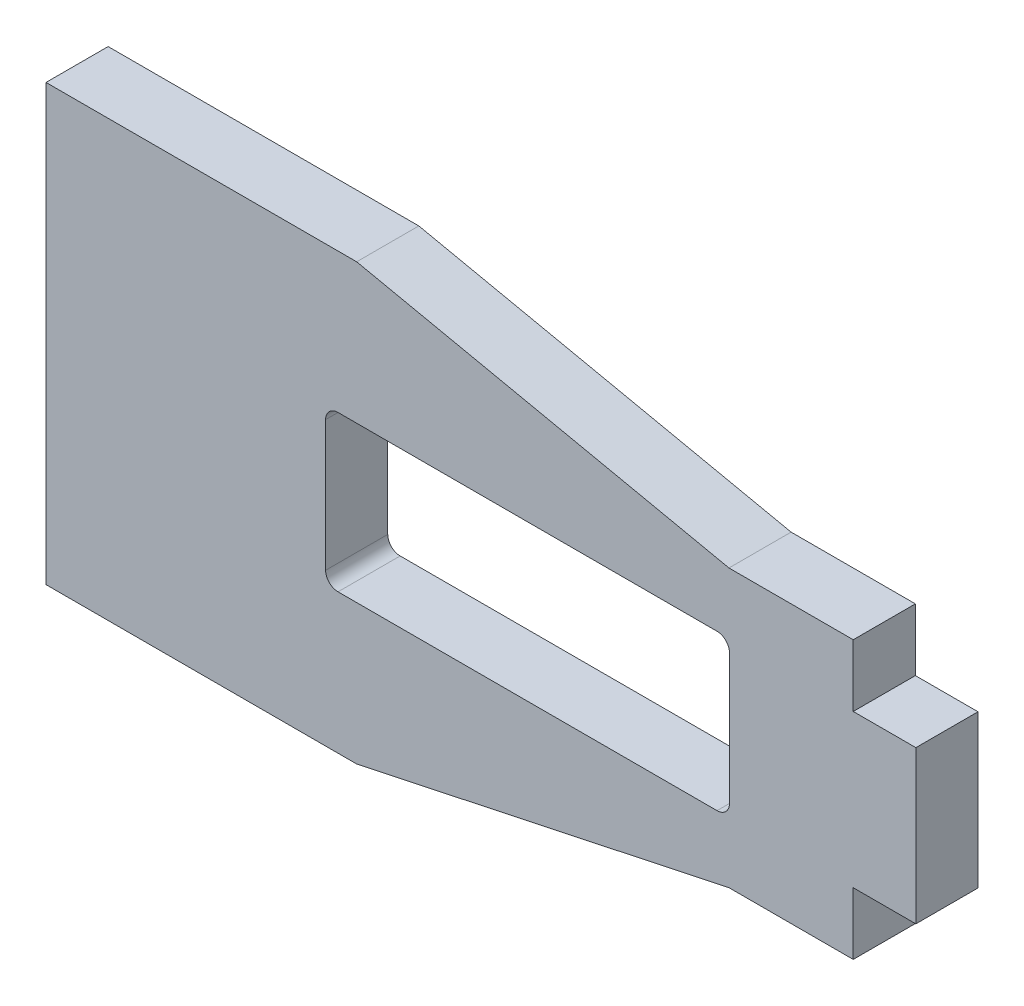
from build123d import *

# Parameters (mm, degrees)
SKETCH_1_W          = 140
SKETCH_1_H          = 70
EXTRUDE_2_DEPTH     = 10
SKETCH_2_W          = 10.079720787
SKETCH_2_H          = 10
SKETCH_2_W_2        = 5
SKETCH_2_H_2        = 25
CUT_EXTRUDE_2_DEPTH = 10
FILLET_1_R          = 2


with BuildPart() as part:
    # 草图1 → 凸台-拉伸2 (new body)
    with BuildSketch(Plane.XY):
        Rectangle(SKETCH_1_W, SKETCH_1_H)
    extrude(amount=EXTRUDE_2_DEPTH)

    # 草图2 → 切除-拉伸2 (cut)
    with BuildSketch(Plane.XY.offset(10)):
        Polygon((39.920279213, 22.281959867), (59.920279213, 22.281959867), (70, 22.281959867), (70, 35), (-20, 35), align=None)
        with Locations((64.960139607, 17.281959867)):
            Rectangle(SKETCH_2_W, SKETCH_2_H)
        with Locations((64.960139607, -17.281959867)):
            Rectangle(SKETCH_2_W, SKETCH_2_H)
        Polygon((70, -22.281959867), (59.920279213, -22.281959867), (39.920279213, -22.281959867), (-20, -35), (70, -35), align=None)
        Polygon((40, -12.5), (40, 0), (40, 12.5), (-20, 12.5), (-20, -12.5), align=None)
        with Locations((-22.5, 0)):
            Rectangle(SKETCH_2_W_2, SKETCH_2_H_2)
    extrude(amount=-CUT_EXTRUDE_2_DEPTH, mode=Mode.SUBTRACT)

    # 圆角1
    fillet_1_edges = [part.edges().sort_by_distance(p)[0] for p in [
        (40, -12.5, 5),
        (-25, -12.5, 5),
        (-25, 12.5, 5),
        (40, 12.5, 5),
    ]]
    fillet(fillet_1_edges, radius=FILLET_1_R)


solid = part.part
